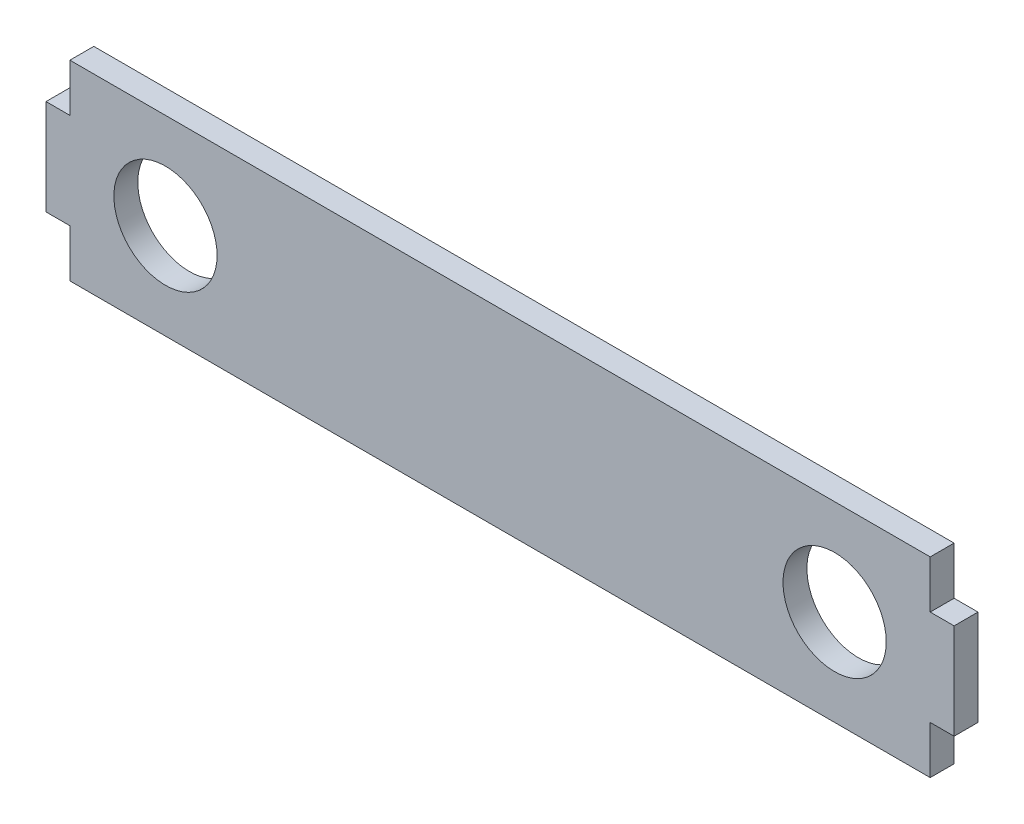
from build123d import *

# Parameters (mm, degrees)
SKETCH1_R           = 3.429
BOSS_EXTRUDE1_DEPTH = 1.5875


with BuildPart() as part:
    # Sketch1 → Boss-Extrude1 (new body)
    with BuildSketch(Plane.XY):
        Polygon((28.575, -3.175), (30.1625, -3.175), (30.1625, 3.175), (28.575, 3.175), (28.575, 6.35), (-28.575, 6.35), (-28.575, 3.175), (-30.1625, 3.175), (-30.1625, -3.175), (-28.575, -3.175), (-28.575, -6.35), (28.575, -6.35), align=None)
        with Locations((-22.225, 0)):
            Circle(SKETCH1_R, mode=Mode.SUBTRACT)
        with Locations((22.225, 0)):
            Circle(SKETCH1_R, mode=Mode.SUBTRACT)
    extrude(amount=-BOSS_EXTRUDE1_DEPTH)


solid = part.part
